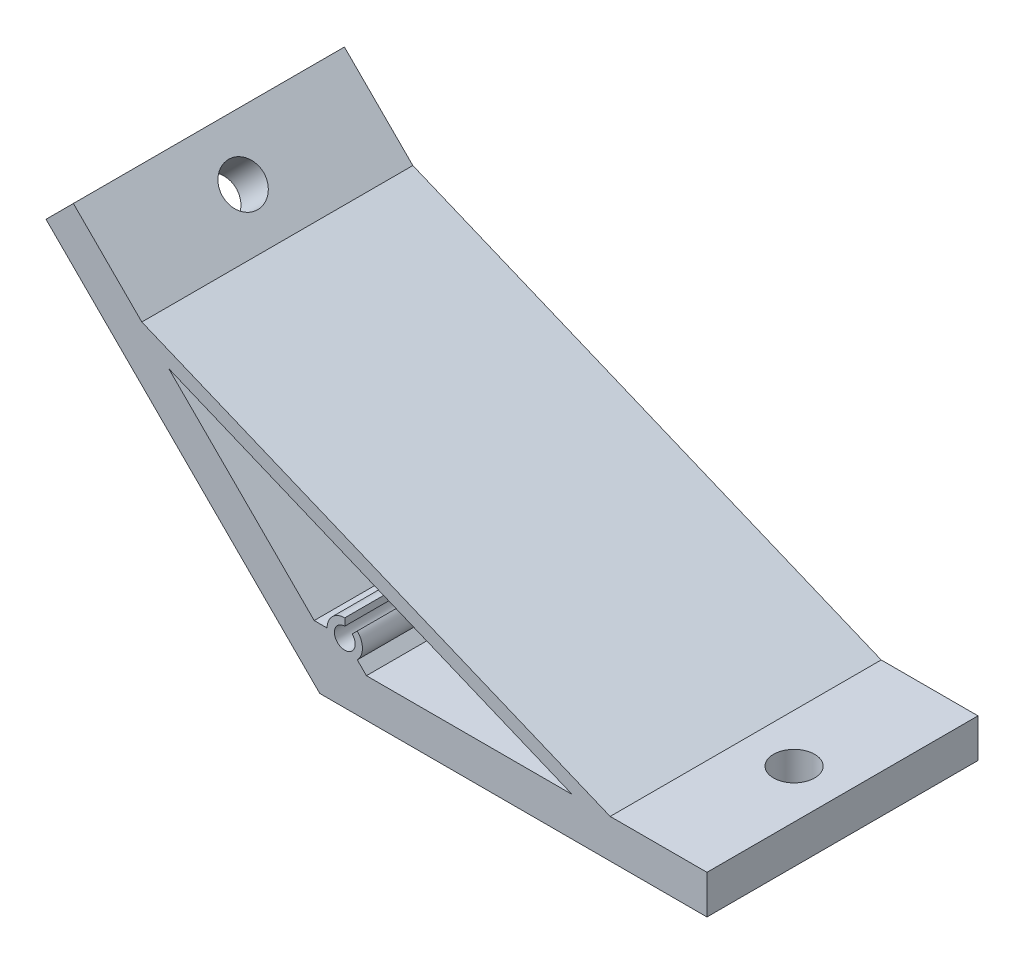
from build123d import *

# Parameters (mm, degrees)
EXTRUDE_1_DEPTH     = 28
SKETCH_3_R          = 4.25
CUT_EXTRUDE_1_DEPTH = 101.620045975


with BuildPart() as part:
    # 草图1 → 凸台-拉伸1 (new, symmetric)
    with BuildSketch(Plane.XY):
        Polygon((80, 0), (0, 0), (-56.568542495, 56.568542495), (-50.911688245, 62.225396744), (-36.769552622, 48.083261121), (60, 8), (80, 8), align=None)
        with BuildLine():
            Line((52.160622211, 8), (9.638600026, 8))
            Line((9.638600026, 8), (7.747166088, 9.891433938))
            ThreePointArc((7.747166088, 9.891433938), (8.816226337, 12.472373689), (7.747166088, 15.05331344))
            Line((7.747166088, 15.05331344), (6.686505916, 13.992653268))
            ThreePointArc((6.686505916, 13.992653268), (4.343456957, 10.486032694), (5.166226337, 14.622373689))
            Line((5.166226337, 14.622373689), (5.166226337, 16.122373689))
            ThreePointArc((5.166226337, 16.122373689), (2.585286586, 15.05331344), (1.516226337, 12.472373689))
            Line((1.516226337, 12.472373689), (-1.15866519, 12.472373689))
            Line((-1.15866519, 12.472373689), (-31.226275427, 42.539983926))
            Line((-31.226275427, 42.539983926), (52.160622211, 8))
        make_face(mode=Mode.SUBTRACT)
    extrude(amount=EXTRUDE_1_DEPTH, both=True)

    # 草图3 → 切除-拉伸1 (cut, through all)
    with BuildSketch(Plane(origin=(0, 8, 0), x_dir=(1, 0, 0), z_dir=(0, 1, 0))):
        with Locations(Location((70, 0, 0), (0, 0, 180))):
            Circle(SKETCH_3_R)
    cut_extrude_1 = extrude(amount=-CUT_EXTRUDE_1_DEPTH, mode=Mode.SUBTRACT)

    # 镜向1: 切除-拉伸1 across plane
    add(cut_extrude_1.mirror(Plane(origin=(0, 0, 0), x_dir=(0, 0, 1), z_dir=(-0.9238795325112867, 0.3826834323650898, 0))), mode=Mode.SUBTRACT)


solid = part.part
